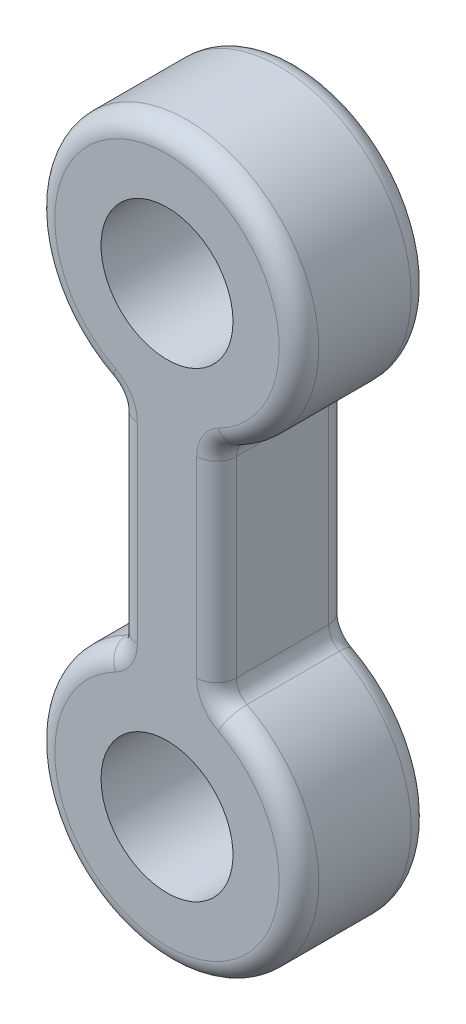
from build123d import *

# Parameters (mm, degrees)
SKETCH1_R           = 10
BOSS_EXTRUDE1_DEPTH = 10
FILLET1_R           = 3


with BuildPart() as part:
    # Sketch1 → Boss-Extrude1 (new, symmetric)
    with BuildSketch(Plane.XY):
        with BuildLine():
            Line((-7.5, 16.459503782), (-7.5, -16.459503782))
            ThreePointArc((-7.5, -16.459503782), (0, -55), (7.5, -16.459503782))
            Line((7.5, -16.459503782), (7.5, 16.459503782))
            ThreePointArc((7.5, 16.459503782), (0, 55), (-7.5, 16.459503782))
        make_face()
        with Locations((0, 35)):
            Circle(SKETCH1_R, mode=Mode.SUBTRACT)
        with Locations(Location((0, -35, 0), (0, 0, 180))):
            Circle(SKETCH1_R, mode=Mode.SUBTRACT)
    extrude(amount=BOSS_EXTRUDE1_DEPTH, both=True)

    # Fillet1
    fillet1_edges = [part.edges().sort_by_distance(p)[0] for p in [
        (0, -55, 10),
        (7.5, 0, 10),
        (0, 55, 10),
        (7.5, 0, -10),
        (0, -55, -10),
        (-7.5, 0, -10),
        (0, 55, -10),
        (7.5, 16.459503782, 0),
        (7.5, -16.459503782, 0),
        (-7.5, -16.459503782, 0),
        (-7.5, 16.459503782, 0),
        (-7.5, 0, 10),
    ]]
    fillet(fillet1_edges, radius=FILLET1_R)


solid = part.part
